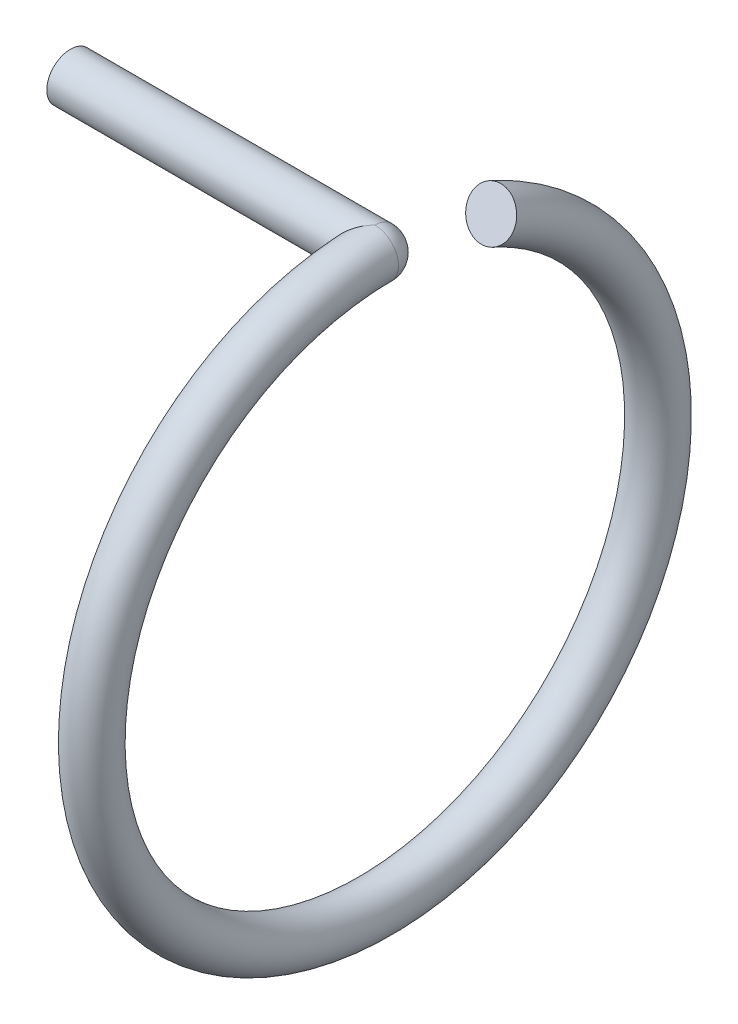
from build123d import *

# Parameters (mm, degrees)
SKETCH6_R = 3.175
SKETCH8_R = 3.175


with BuildPart() as part:
    # Sweep1: sweep along a path in Sketch5
    with BuildLine(Plane(origin=(0, 0, 0), x_dir=(0, 0, -1), z_dir=(1, 0, 0))) as sweep1_path:
        ThreePointArc((0, 38.1), (-8.001782337, -37.250254757), (15.646636775, 34.738922805))
    # Sketch6 → Sweep1 (sweep)
    with BuildSketch(Plane.XY):
        with Locations((0, 38.1)):
            Circle(SKETCH6_R)
    sweep(path=sweep1_path.line)

    # Sweep2: sweep along a path in Sketch7
    with BuildLine(Plane.XY) as sweep2_path:
        Line((0, 38.1), (-40.976396272, 38.1))
    # Sketch8 → Sweep2 (sweep)
    with BuildSketch(Plane(origin=(0, 0, 0), x_dir=(0, 0, -1), z_dir=(1, 0, 0))):
        with Locations((0, 38.1)):
            Circle(SKETCH8_R)
    sweep(path=sweep2_path.line)

    # Sketch9 → Revolve7 (revolve)
    with BuildSketch(Plane(origin=(0, 0, 0), x_dir=(0, 0, -1), z_dir=(1, 0, 0))):
        with BuildLine():
            Line((0, 41.275), (0, 34.925))
            ThreePointArc((0, 34.925), (3.175, 38.1), (0, 41.275))
        make_face()
    revolve(axis=Axis((0, 0, 0), (0, 1, 0)))


solid = part.part
